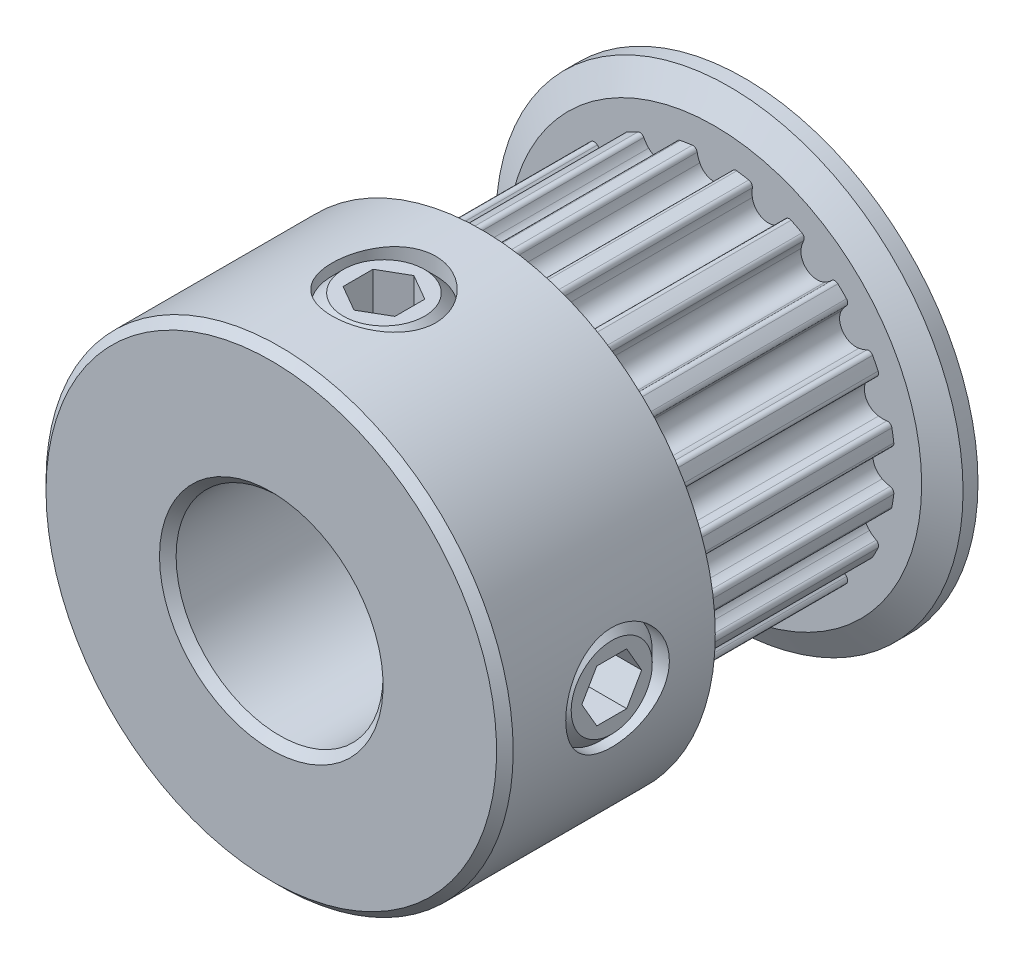
from build123d import *

# Parameters (mm, degrees)
CUT_EXTRUDE1_START = 0.38
CUT_EXTRUDE1_DEPTH = 7.37
CIRPATTERN1_COUNT  = 20
SKETCH4_R          = 1.7526
CUT_EXTRUDE2_DEPTH = 14.741178989
CUT_EXTRUDE3_DEPTH = 1.31445
CIRPATTERN3_COUNT  = 2
CIRPATTERN3_ANGLE  = 90
CHAMFER1_SIZE      = 0.28075


with BuildPart() as part:
    # Sketch2 → Revolve1 (revolve)
    with BuildSketch(Plane(origin=(0, 0, 0), x_dir=(0, 0, -1), z_dir=(1, 0, 0)), mode=Mode.PRIVATE) as revolve1_sk:
        Polygon((-8, 3.5), (8, 3.5), (8, 7.9), (7.495, 7.9), (6.99, 7.00425), (6.99, 6.1085), (-0.38, 6.1085), (-0.38, 7.00425), (-0.885, 7.9), (-8, 7.9), align=None)
    revolve(revolve1_sk.sketch.rotate(Axis((0, 0, 8), (0, 0, -1)), 90), axis=Axis((0, 0, 8), (0, 0, -1)))

    # Sketch3 → Cut-Extrude1 (cut)
    with BuildSketch(Plane.XY.offset(CUT_EXTRUDE1_START)):
        with BuildLine():
            Line((2.579897544, 7.9), (-2.579897544, 7.9))
            Line((-2.579897544, 7.9), (-1.896292335, 5.806707124))
            ThreePointArc((-1.896292335, 5.806707124), (-1.330166224, 5.961914966), (-0.751756185, 6.062065233))
            ThreePointArc((-0.751756185, 6.062065233), (-0.643911332, 6.033664451), (-0.58547487, 5.93867868))
            ThreePointArc((-0.58547487, 5.93867868), (-0.551683777, 5.801420225), (-0.498876404, 5.670297753))
            ThreePointArc((-0.498876404, 5.670297753), (0, 5.3585), (0.498876404, 5.670297753))
            ThreePointArc((0.498876404, 5.670297753), (0.551683777, 5.801420225), (0.58547487, 5.93867868))
            ThreePointArc((0.58547487, 5.93867868), (0.643911332, 6.033664451), (0.751756185, 6.062065233))
            ThreePointArc((0.751756185, 6.062065233), (1.330166224, 5.961914966), (1.896292335, 5.806707124))
            Line((1.896292335, 5.806707124), (2.579897544, 7.9))
        make_face()
    cut_extrude1 = extrude(amount=-CUT_EXTRUDE1_DEPTH, mode=Mode.SUBTRACT)

    # CirPattern1: Cut-Extrude1 ×20 about axis
    cirpattern1_axis = Axis((0, 0, 0), (0, 0, 1))
    for i in range(1, CIRPATTERN1_COUNT):
        add(cut_extrude1.rotate(cirpattern1_axis, i * 360 / CIRPATTERN1_COUNT), mode=Mode.SUBTRACT)

    # Sketch4 → Cut-Extrude2 (cut, through all)
    with BuildSketch(Plane(origin=(0, 0, 0), x_dir=(0, -1, 0), z_dir=(1, 0, 0))):
        with Locations(Location((0, -4.19, 0), (0, 0, 270))):
            Circle(SKETCH4_R)
    cut_extrude2 = extrude(amount=CUT_EXTRUDE2_DEPTH, mode=Mode.SUBTRACT)

    # Sketch5 → Revolve2 (revolve)
    with BuildSketch(Plane.XY.offset(4.19), mode=Mode.PRIVATE) as revolve2_sk:
        Polygon((3.5, -1.3716), (3.5, 0), (7.703141777, 0), (7.703141777, -1.3716), (7.322141777, -1.7526), (3.881, -1.7526), align=None)
    revolve2 = revolve(revolve2_sk.sketch.rotate(Axis((3.5, 0, 4.19), (1, 0, 0)), 270), axis=Axis((3.5, 0, 4.19), (1, 0, 0)))

    # Sketch6 → Cut-Extrude3 (cut)
    with BuildSketch(Plane(origin=(7.703141777, 5.384140679, 0), x_dir=(0, -1, 0), z_dir=(-1, 0, 0))):
        Polygon((5.384140679, 5.201864082), (4.507840679, 4.695932041), (4.507840679, 3.684067959), (5.384140679, 3.178135918), (6.260440679, 3.684067959), (6.260440679, 4.695932041), align=None)
    cut_extrude3 = extrude(amount=CUT_EXTRUDE3_DEPTH, mode=Mode.SUBTRACT)

    # CirPattern3: Cut-Extrude2, Revolve2, Cut-Extrude3 ×2 about axis
    cirpattern3_axis = Axis((0, 0, 0), (0, 0, 1))
    add([cut_extrude2.rotate(cirpattern3_axis, i * CIRPATTERN3_ANGLE / (CIRPATTERN3_COUNT - 1)) for i in range(1, CIRPATTERN3_COUNT)], mode=Mode.SUBTRACT)
    add([revolve2.rotate(cirpattern3_axis, i * CIRPATTERN3_ANGLE / (CIRPATTERN3_COUNT - 1)) for i in range(1, CIRPATTERN3_COUNT)])
    add([cut_extrude3.rotate(cirpattern3_axis, i * CIRPATTERN3_ANGLE / (CIRPATTERN3_COUNT - 1)) for i in range(1, CIRPATTERN3_COUNT)], mode=Mode.SUBTRACT)

    # Chamfer1
    chamfer1_edges = [part.edges().sort_by_distance(p)[0] for p in [
        (-3.5, 0, 8),
        (-7.9, 0, 8),
    ]]
    chamfer(chamfer1_edges, length=CHAMFER1_SIZE)


solid = part.part
